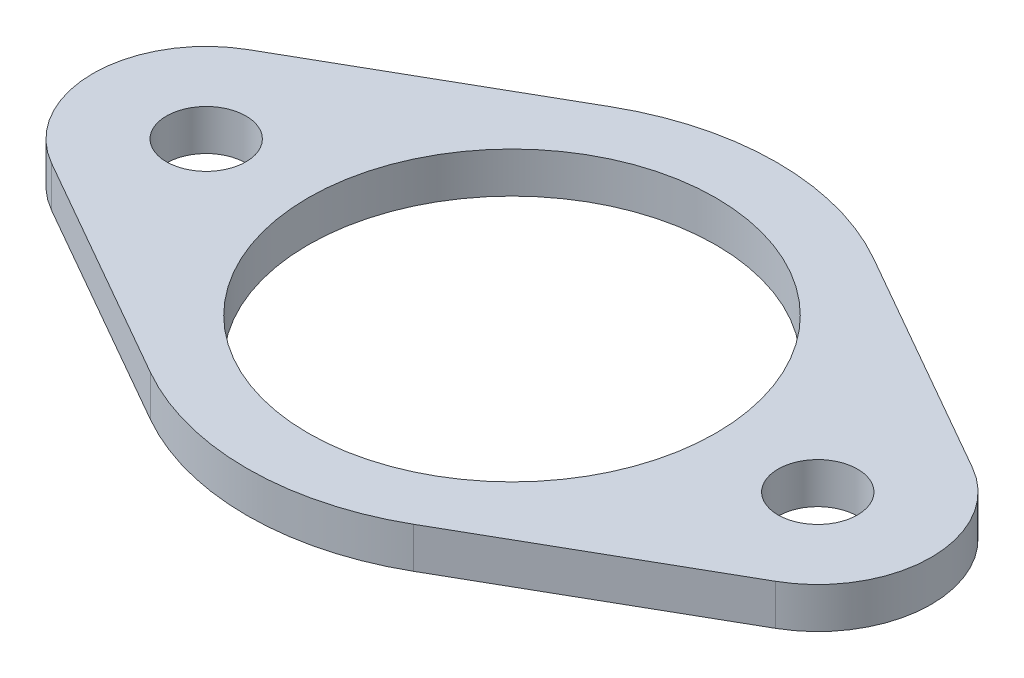
from build123d import *

# Parameters (mm, degrees)
SKETCH1_R           = 5
SKETCH1_R_2         = 0.975
BOSS_EXTRUDE1_DEPTH = 1


with BuildPart() as part:
    # Sketch1 → Boss-Extrude1 (new body)
    with BuildSketch(Plane(origin=(0, 0, 0), x_dir=(1, 0, 0), z_dir=(0, 1, 0))):
        with BuildLine():
            Line((-8.87888, 2.413936608), (-3.224, 5.644096385))
            ThreePointArc((-3.224, 5.644096385), (0, 6.5), (3.224, 5.644096385))
            Line((3.224, 5.644096385), (8.87888, 2.413936608))
            ThreePointArc((8.87888, 2.413936608), (10.28, 0), (8.87888, -2.413936608))
            Line((8.87888, -2.413936608), (3.224, -5.644096385))
            ThreePointArc((3.224, -5.644096385), (0, -6.5), (-3.224, -5.644096385))
            Line((-3.224, -5.644096385), (-8.87888, -2.413936608))
            ThreePointArc((-8.87888, -2.413936608), (-10.28, 0), (-8.87888, 2.413936608))
        make_face()
        with Locations(Location((0, 0, 0), (0, 0, 270))):
            Circle(SKETCH1_R, mode=Mode.SUBTRACT)
        with Locations(Location((-7.5, 0, 0), (0, 0, 270))):
            Circle(SKETCH1_R_2, mode=Mode.SUBTRACT)
        with Locations(Location((7.5, 0, 0), (0, 0, 270))):
            Circle(SKETCH1_R_2, mode=Mode.SUBTRACT)
    extrude(amount=BOSS_EXTRUDE1_DEPTH)


solid = part.part
